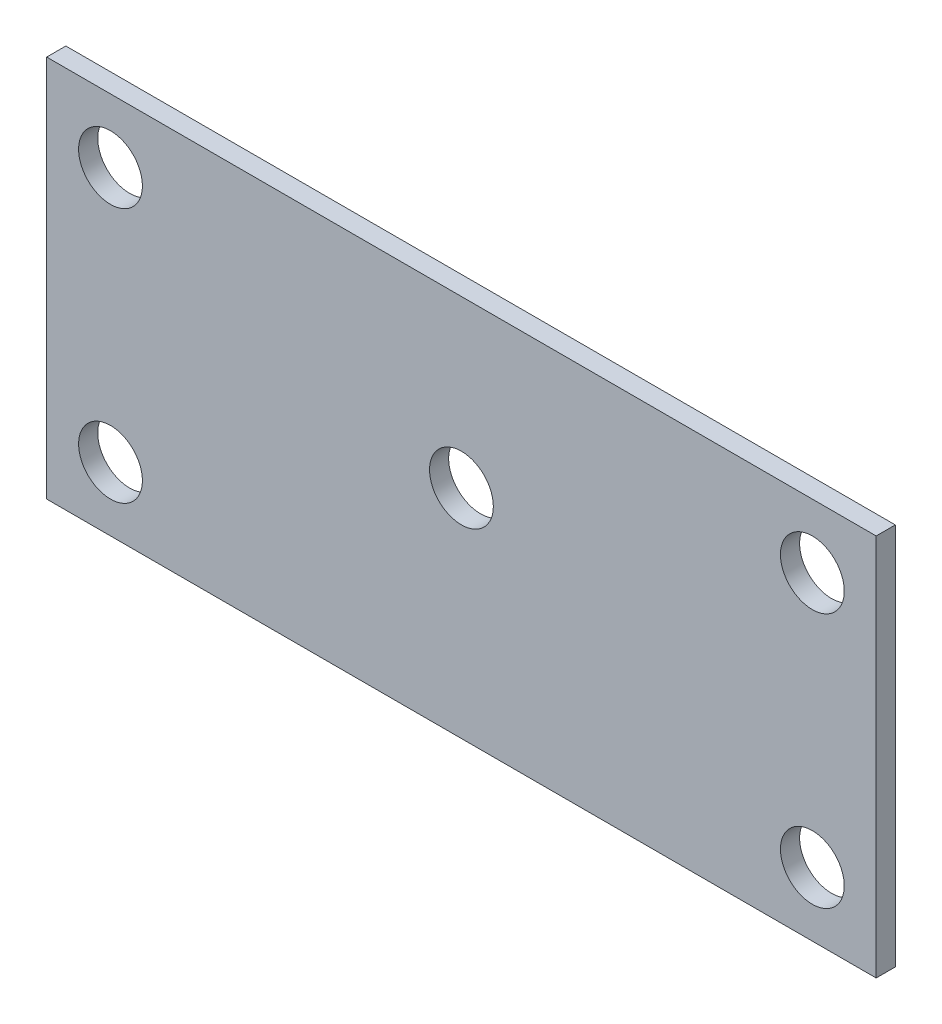
from build123d import *
from build123d.topology import SkipClean

# Parameters (mm, degrees)
ESQUISSE1_R        = 5
BOSS_EXTRU_1_DEPTH = 3


with BuildPart() as part:
    # Esquisse1 → Boss.-Extru.1 (new body)
    with BuildSketch(Plane.XY):
        with BuildLine():
            Line((45, 39), (45, 60))
            Line((45, 60), (-20, 60))
            Line((-20, 60), (-20, 0))
            Line((-20, 0), (45, 0))
            Line((45, 0), (45, 29))
            ThreePointArc((45, 29), (40, 34), (45, 39))
        make_face()
        with Locations((-10, 50)):
            Circle(ESQUISSE1_R, mode=Mode.SUBTRACT)
        with Locations((-10, 10)):
            Circle(ESQUISSE1_R, mode=Mode.SUBTRACT)
    boss_extru_1 = extrude(amount=BOSS_EXTRU_1_DEPTH)

    # Symétrie1: Boss.-Extru.1 across plane
    with SkipClean():  # the faces are left unmerged after this step: merging them gives an invalid solid
        add(boss_extru_1.mirror(Plane(origin=(45, 0, 3), x_dir=(0, 0, 1), z_dir=(1, 0, 0))))


solid = part.part
